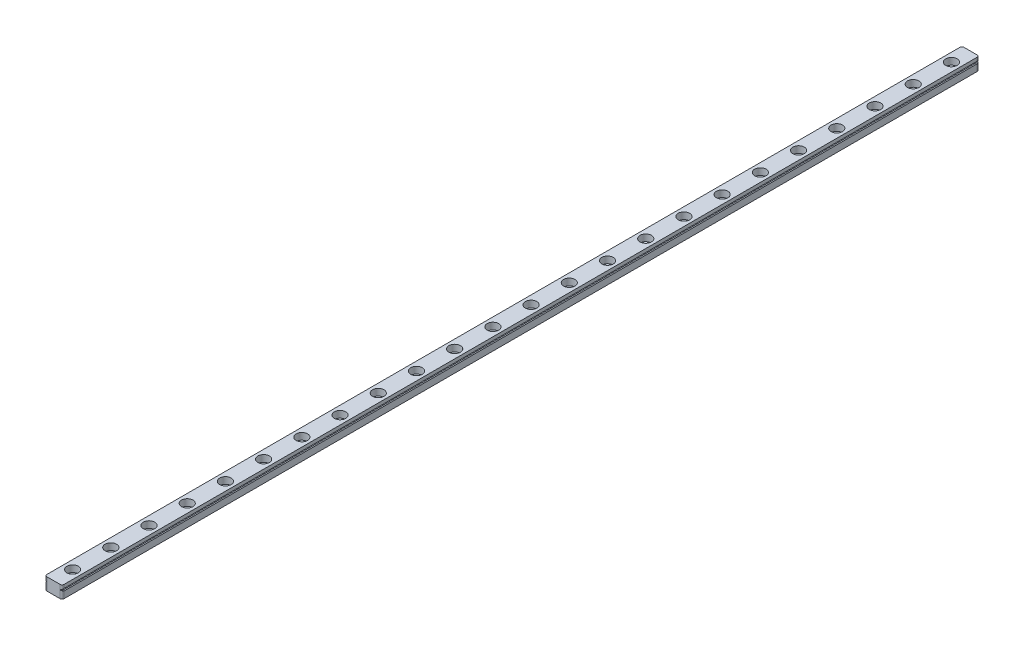
from build123d import *

# Parameters (mm, degrees)
EXTRUDE_1_DEPTH        = 480
SKETCH_2_R             = 3
CUT_EXTRUDE_1_DEPTH    = 3.5
SKETCH_3_R             = 1.75
CUT_EXTRUDE_2_DEPTH    = 481.033852973
PATTERN_LINEAR_1_COUNT = 30
PATTERN_LINEAR_1_PITCH = 20
FILLET_1_R             = 1


with BuildPart() as part:
    # 草图1 → 凸台-拉伸1 (new body)
    with BuildSketch(Plane.XY):
        Polygon((-4.5, -3.663424778), (4.5, -3.663424778), (4.5, -0.163424778), (4.146446609, 0.190128613), (3.646446609, 0.190128613), (3.646446609, 0.690128613), (4.146446609, 0.690128613), (4.5, 1.043682003), (4.5, 2.836575222), (-4.5, 2.836575222), (-4.5, 1.043682003), (-4.146446609, 0.690128613), (-3.646446609, 0.690128613), (-3.646446609, 0.190128613), (-4.146446609, 0.190128613), (-4.5, -0.163424778), align=None)
    extrude(amount=EXTRUDE_1_DEPTH)

    # 草图2 → 切除-拉伸1 (cut)
    with BuildSketch(Plane(origin=(0, 2.836575222, 0), x_dir=(1, 0, 0), z_dir=(0, 1, 0))):
        with Locations(Location((0, -470, 0), (0, 0, 270))):
            Circle(SKETCH_2_R)
    cut_extrude_1 = extrude(amount=-CUT_EXTRUDE_1_DEPTH, mode=Mode.SUBTRACT)

    # 草图3 → 切除-拉伸2 (cut, through all)
    with BuildSketch(Plane(origin=(0, -0.663424778, 0), x_dir=(1, 0, 0), z_dir=(0, 1, 0))):
        with Locations(Location((0, -470, 0), (0, 0, 270))):
            Circle(SKETCH_3_R)
    cut_extrude_2 = extrude(amount=-CUT_EXTRUDE_2_DEPTH, mode=Mode.SUBTRACT)

    # 阵列(线性)1: 切除-拉伸1, 切除-拉伸2 ×30
    with Locations(*[(0, 0, -i * PATTERN_LINEAR_1_PITCH) for i in range(1, PATTERN_LINEAR_1_COUNT)]):
        add(cut_extrude_1, mode=Mode.SUBTRACT)
        add(cut_extrude_2, mode=Mode.SUBTRACT)

    # 圆角1
    fillet_1_edges = [part.edges().sort_by_distance(p)[0] for p in [
        (4.5, -1.913424778, 0),
        (-4.5, -1.913424778, 0),
        (4.5, -1.913424778, 480),
        (-4.5, -1.913424778, 480),
    ]]
    fillet(fillet_1_edges, radius=FILLET_1_R)


solid = part.part
